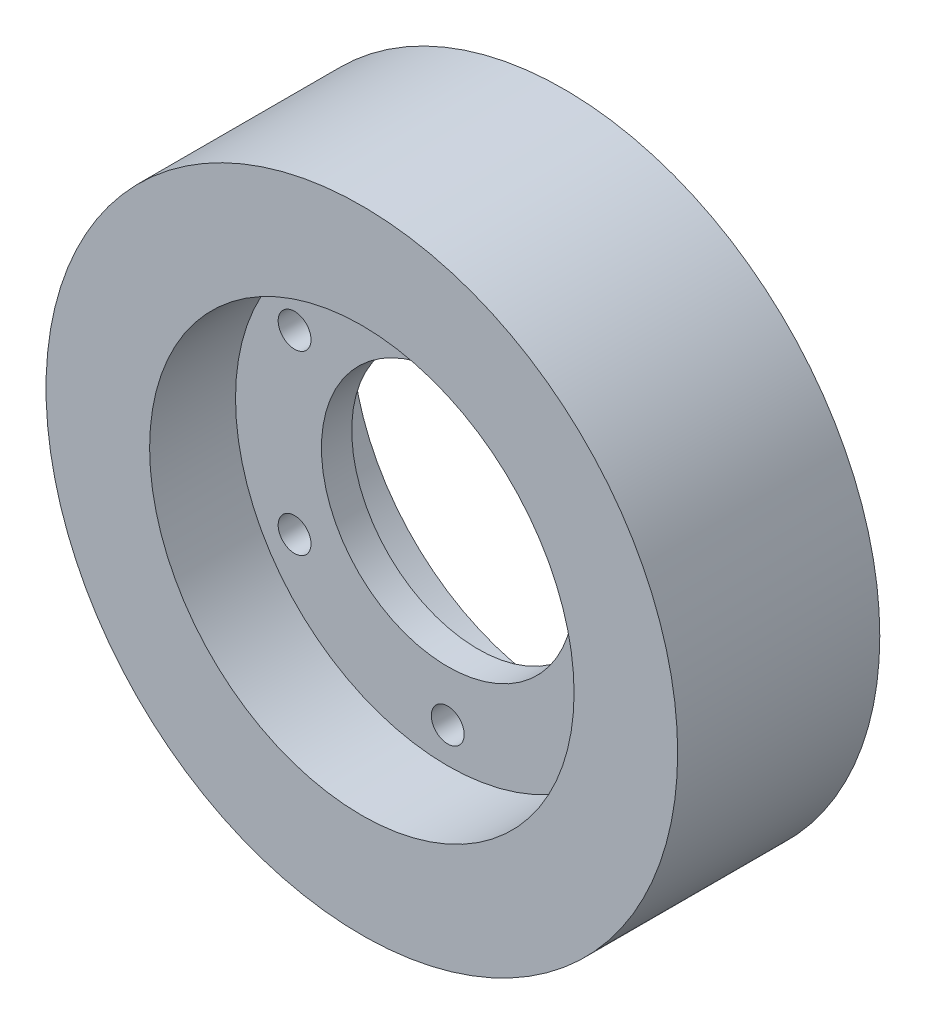
from build123d import *

# Parameters (mm, degrees)
SKETCH_1_R      = 42
SKETCH_1_R_2    = 25
SKETCH_1_R_3    = 3.25
EXTRUDE_1_DEPTH = 6
EXTRUDE_START   = -3
SKETCH_2_R      = 62.5
SKETCH_2_R_2    = 42
EXTRUDE_2_DEPTH = 20


with BuildPart() as part:
    # 草图1 → 凸台-拉伸1 (new body)
    with BuildSketch(Plane.XY):
        Circle(SKETCH_1_R)
        Circle(SKETCH_1_R_2, mode=Mode.SUBTRACT)
        with Locations((0, 35)):
            Circle(SKETCH_1_R_3, mode=Mode.SUBTRACT)
        with Locations((30.310889132, 17.5)):
            Circle(SKETCH_1_R_3, mode=Mode.SUBTRACT)
        with Locations((30.310889132, -17.5)):
            Circle(SKETCH_1_R_3, mode=Mode.SUBTRACT)
        with Locations((0, -35)):
            Circle(SKETCH_1_R_3, mode=Mode.SUBTRACT)
        with Locations((-30.310889132, -17.5)):
            Circle(SKETCH_1_R_3, mode=Mode.SUBTRACT)
        with Locations((-30.310889132, 17.5)):
            Circle(SKETCH_1_R_3, mode=Mode.SUBTRACT)
    extrude(amount=EXTRUDE_1_DEPTH)

    # 草图2 → 凸台-拉伸2 (add, symmetric)
    with BuildSketch(Plane.XY.offset(6).offset(EXTRUDE_START)):
        Circle(SKETCH_2_R)
        Circle(SKETCH_2_R_2, mode=Mode.SUBTRACT)
    extrude(amount=EXTRUDE_2_DEPTH, both=True)


solid = part.part
